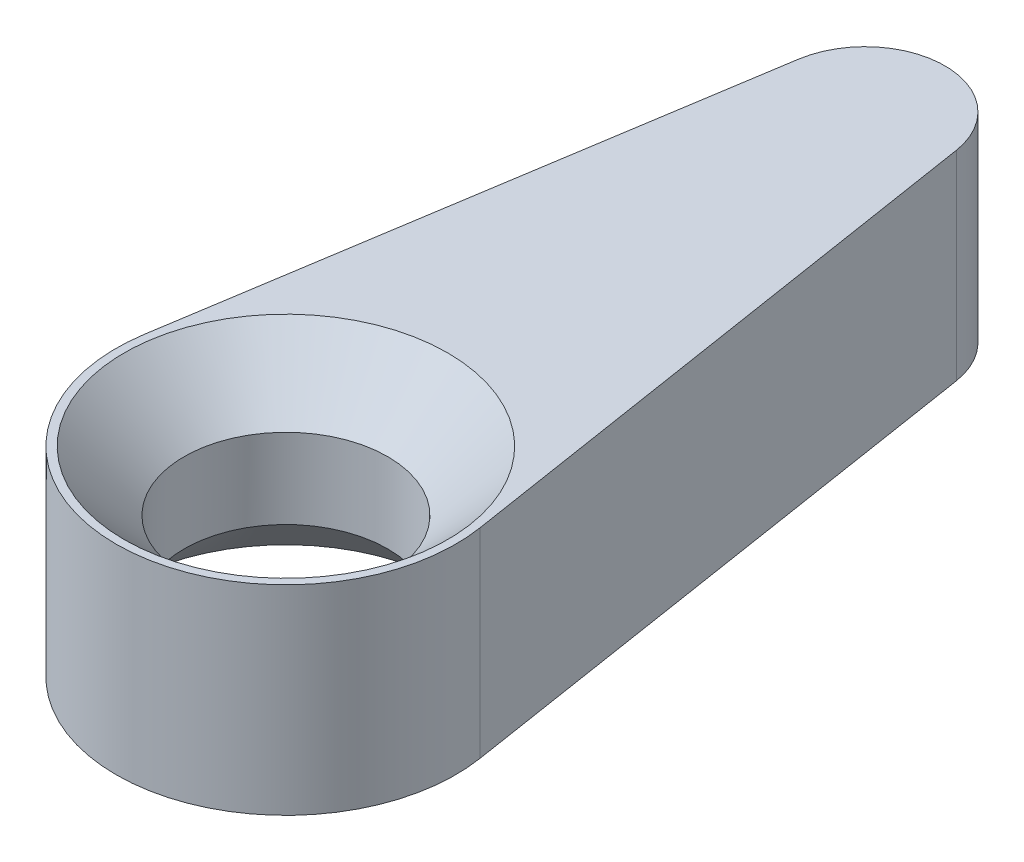
from build123d import *

# Parameters (mm, degrees)
SKETCH1_R           = 10.795
SKETCH1_R_2         = 6.477
BOSS_EXTRUDE1_DEPTH = 12.7
CHAMFER1_SIZE       = 3.81


with BuildPart() as part:
    # Sketch1 → Boss-Extrude1 (new body)
    # profile 1 of 2: a face of its own
    with BuildSketch(Plane(origin=(0, 0, 0), x_dir=(1, 0, 0), z_dir=(0, 1, 0))):
        with BuildLine():
            Line((-5.01846801, 37.618275862), (-10.664244521, 1.675086207))
            ThreePointArc((-10.664244521, 1.675086207), (0, 10.795), (10.664244521, 1.675086207))
            Line((10.664244521, 1.675086207), (5.01846801, 37.618275862))
            ThreePointArc((5.01846801, 37.618275862), (0, 41.91), (-5.01846801, 37.618275862))
        make_face()
    # profile 2 of 2: a face of its own
    with BuildSketch(Plane(origin=(0, 0, 0), x_dir=(1, 0, 0), z_dir=(0, 1, 0))):
        Circle(SKETCH1_R)
        with Locations(Location((0, 0, 0), (0, 0, 270))):
            Circle(SKETCH1_R_2, mode=Mode.SUBTRACT)
    extrude(amount=BOSS_EXTRUDE1_DEPTH)

    # Chamfer1
    chamfer1_edges = [part.edges().sort_by_distance(p)[0] for p in [
        (0, 12.7, -6.477),
        (0, 0, -6.477),
    ]]
    chamfer(chamfer1_edges, length=CHAMFER1_SIZE)


solid = part.part
